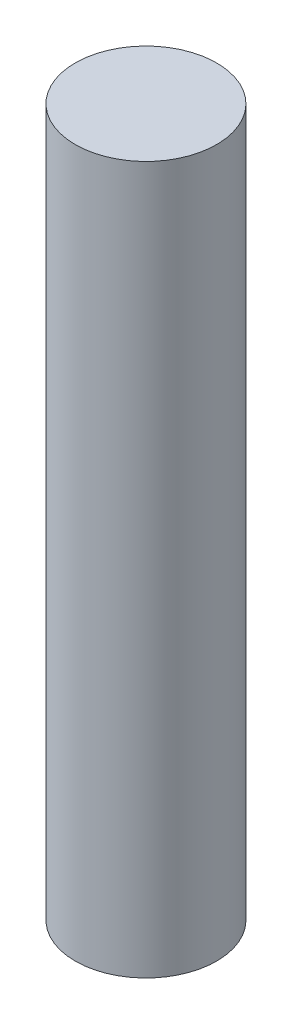
from build123d import *

# Parameters (mm, degrees)
SKETCH1_R           = 6
BOSS_EXTRUDE1_DEPTH = 60


with BuildPart() as part:
    # Sketch1 → Boss-Extrude1 (new body)
    with BuildSketch(Plane(origin=(0, 0, 0), x_dir=(1, 0, 0), z_dir=(0, 1, 0))):
        with Locations(Location((0, 0, 0), (0, 0, 270))):
            Circle(SKETCH1_R)
    extrude(amount=BOSS_EXTRUDE1_DEPTH)


solid = part.part
